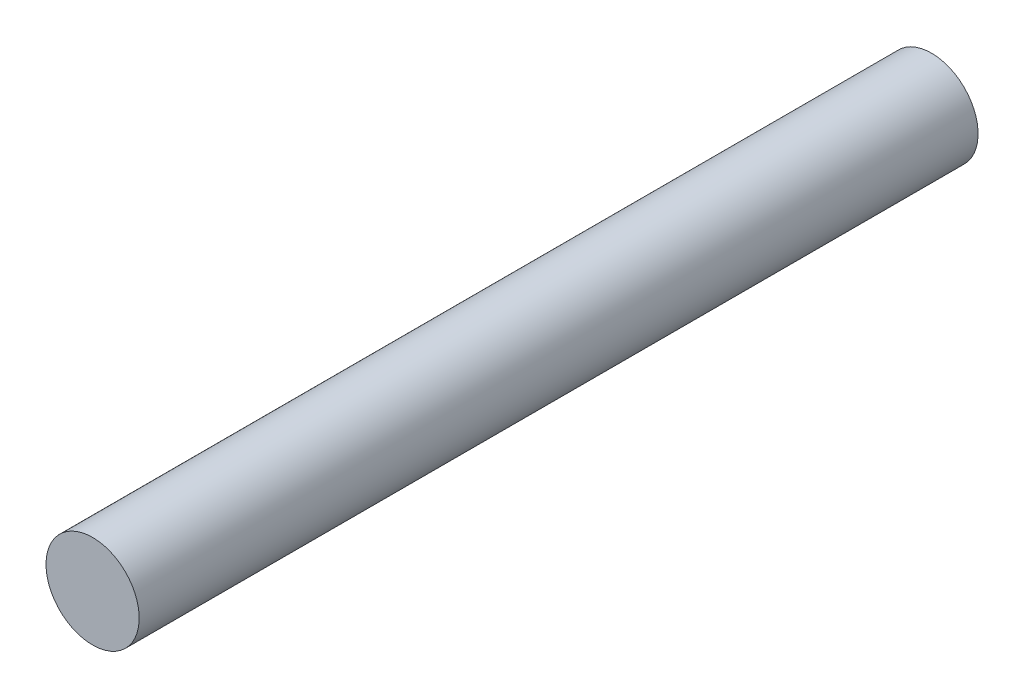
from build123d import *

# Parameters (mm, degrees)
SKETCH1_R           = 2.5
BOSS_EXTRUDE1_DEPTH = 45


with BuildPart() as part:
    # Sketch1 → Boss-Extrude1 (new body)
    with BuildSketch(Plane.XY):
        with Locations(Location((0, 0, 0), (0, 0, 180))):
            Circle(SKETCH1_R)
    extrude(amount=BOSS_EXTRUDE1_DEPTH)


solid = part.part
